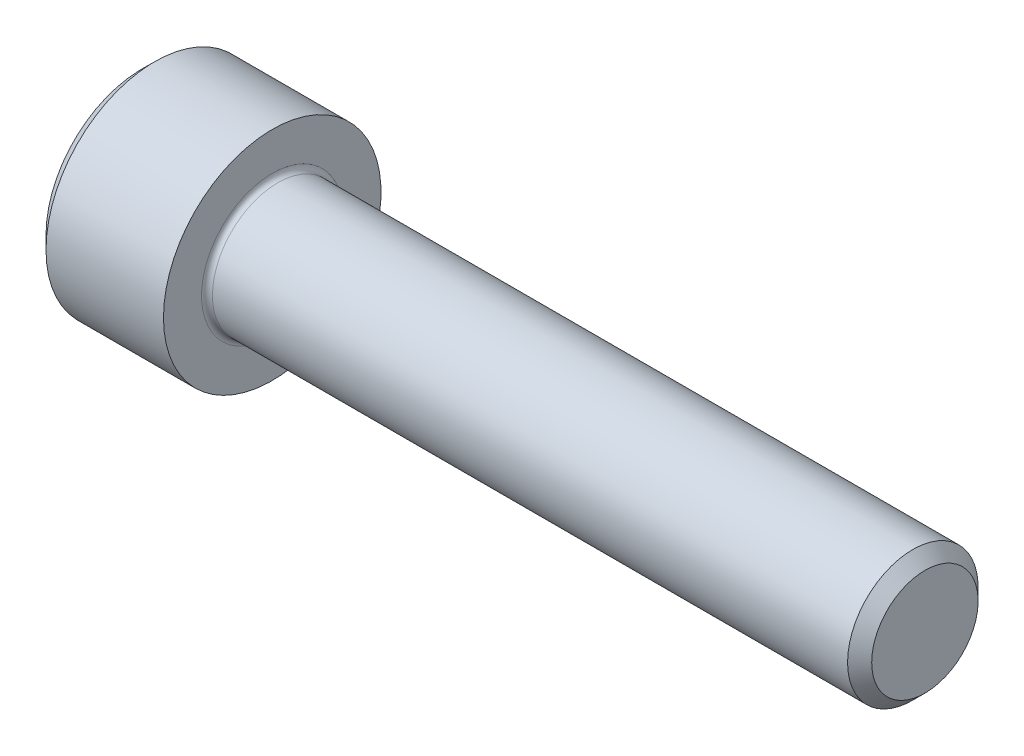
from build123d import *

# Parameters (mm, degrees)
FILLET1_R   = 0.25
HEX_2_DEPTH = 3


with BuildPart() as part:
    # BodySke → Base-Revolve (revolve)
    with BuildSketch(Plane.XY, mode=Mode.PRIVATE) as base_revolve_sk:
        Polygon((0, 0), (0, 4.4), (0.6, 5), (6, 5), (6, 3), (35.4455, 3), (36, 2.4455), (36, 0), align=None)
    revolve(base_revolve_sk.sketch.rotate(Axis((-31.75, 0, 0), (1, 0, 0)), 90), axis=Axis((-31.75, 0, 0), (1, 0, 0)))

    # Fillet1
    fillet1_edges = [part.edges().sort_by_distance(p)[0] for p in [
        (6, 0, -3),
    ]]
    fillet(fillet1_edges, radius=FILLET1_R)

    # Sketch2 → Hex-PreBroach (revolve, cut)
    with BuildSketch(Plane.XY, mode=Mode.PRIVATE) as hex_prebroach_sk:
        Polygon((0, 2.542), (3, 2.542), (4.467624384, 0), (0, 0), align=None)
    revolve(hex_prebroach_sk.sketch.rotate(Axis((0, 0, 0), (1, 0, 0)), 90), axis=Axis((0, 0, 0), (1, 0, 0)), mode=Mode.SUBTRACT)

    # Sketch3 → Hex 2 (cut)
    with BuildSketch(Plane(origin=(0, 0, 0), x_dir=(0, 0.500000000000001, 0.866025403784438), z_dir=(-1, 0, 0))):
        Polygon((1.467624384, 2.542), (-1.467624384, 2.542), (-2.935248769, 0), (-1.467624384, -2.542), (1.467624384, -2.542), (2.935248769, 0), align=None)
    extrude(amount=-HEX_2_DEPTH, mode=Mode.SUBTRACT)


solid = part.part
